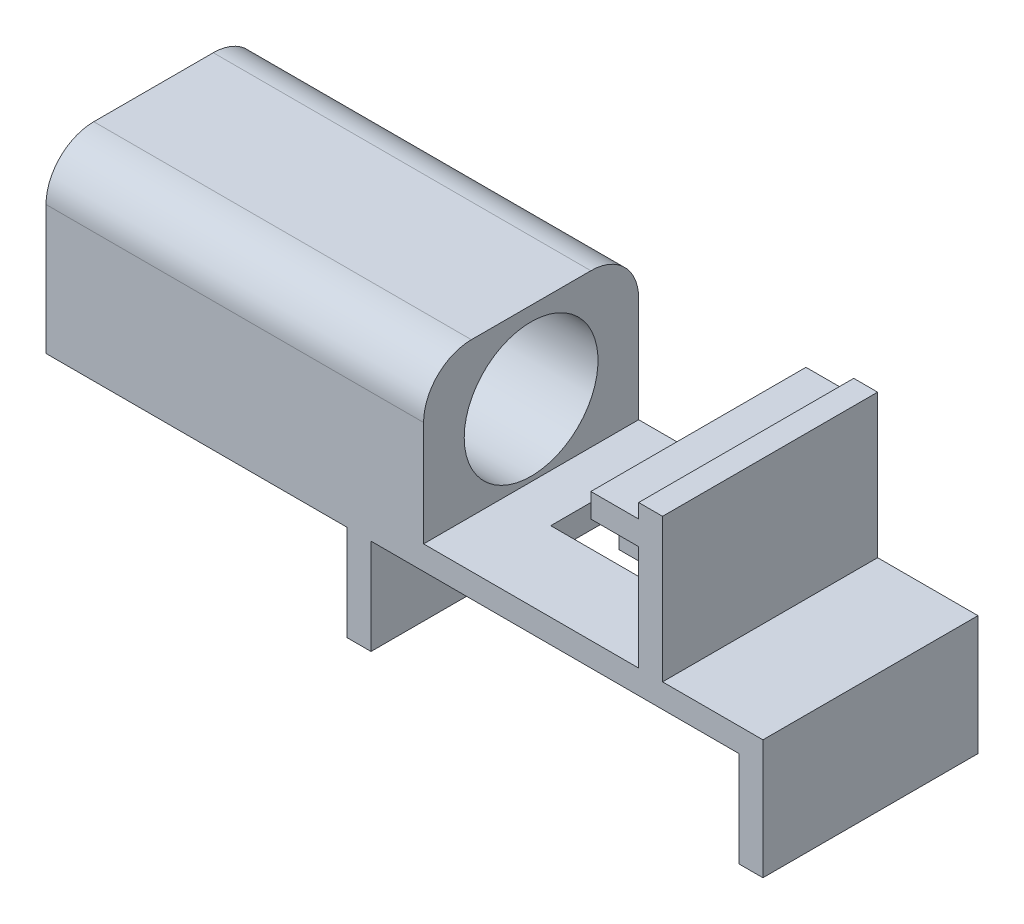
from build123d import *

# Parameters (mm, degrees)
SKETCH1_W           = 150
SKETCH1_H           = 45
BOSS_EXTRUDE1_DEPTH = 5
SKETCH2_W           = 5
SKETCH2_H           = 45
BOSS_EXTRUDE2_DEPTH = 20
SKETCH3_W           = 5
SKETCH3_H           = 45
BOSS_EXTRUDE3_DEPTH = 20
SKETCH4_W           = 35
SKETCH4_H           = 11.8
CUT_EXTRUDE1_DEPTH  = 81.816149376
SKETCH5_W           = 30
SKETCH5_H           = 3
BOSS_EXTRUDE4_DEPTH = 4
SKETCH7_W           = 5
SKETCH7_H           = 45
BOSS_EXTRUDE5_DEPTH = 30
SKETCH8_W           = 79
SKETCH8_H           = 45
BOSS_EXTRUDE6_DEPTH = 32
CUT_EXTRUDE2_REACH  = 158.126
SKETCH9_R           = 14
FILLET1_R           = 10
SKETCH10_W          = 45
SKETCH10_H          = 5
BOSS_EXTRUDE7_DEPTH = 10
CUT_EXTRUDE3_REACH  = 88.604
SKETCH11_R          = 2.55
CUT_EXTRUDE4_DEPTH  = 4
LPATTERN1_COUNT     = 2
LPATTERN1_PITCH     = 30


with BuildPart() as part:
    # Sketch1 → Boss-Extrude1 (new body)
    with BuildSketch(Plane(origin=(0, 0, 0), x_dir=(1, 0, 0), z_dir=(0, 1, 0))):
        Rectangle(SKETCH1_W, SKETCH1_H)
    extrude(amount=BOSS_EXTRUDE1_DEPTH)

    # Sketch2 → Boss-Extrude2 (add)
    with BuildSketch(Plane.XZ):
        with Locations((72.5, 0)):
            Rectangle(SKETCH2_W, SKETCH2_H)
    extrude(amount=BOSS_EXTRUDE2_DEPTH)

    # Sketch3 → Boss-Extrude3 (add)
    with BuildSketch(Plane.XZ):
        with Locations((-9.5, 0)):
            Rectangle(SKETCH3_W, SKETCH3_H)
    extrude(amount=BOSS_EXTRUDE3_DEPTH)

    # Sketch4 → Cut-Extrude1 (cut, through all)
    with BuildSketch(Plane.XZ):
        with Locations((31.5, 0)):
            Rectangle(SKETCH4_W, SKETCH4_H)
    extrude(amount=-CUT_EXTRUDE1_DEPTH, mode=Mode.SUBTRACT)

    # Sketch5 → Boss-Extrude4 (add)
    with BuildSketch(Plane.XZ):
        with Locations((31.5, -7.4)):
            Rectangle(SKETCH5_W, SKETCH5_H)
    boss_extrude4 = extrude(amount=BOSS_EXTRUDE4_DEPTH)

    # Mirror1: Boss-Extrude4 across plane
    add(boss_extrude4.mirror(Plane.XY))

    # Sketch7 → Boss-Extrude5 (add)
    with BuildSketch(Plane(origin=(0, 5, 0), x_dir=(1, 0, 0), z_dir=(0, 1, 0))):
        with Locations((51.5, 0)):
            Rectangle(SKETCH7_W, SKETCH7_H)
    extrude(amount=BOSS_EXTRUDE5_DEPTH)

    # Sketch8 → Boss-Extrude6 (add)
    with BuildSketch(Plane(origin=(0, 5, 0), x_dir=(1, 0, 0), z_dir=(0, 1, 0))):
        with Locations((-35.5, 0)):
            Rectangle(SKETCH8_W, SKETCH8_H)
    extrude(amount=BOSS_EXTRUDE6_DEPTH)

    # Sketch9 → Cut-Extrude2 (cut, up to next)
    with BuildSketch(Plane.ZY.offset(75), mode=Mode.PRIVATE) as cut_extrude2_sk1:
        with Locations((0, 20)):
            Circle(SKETCH9_R)
    cut_extrude2_tool1 = extrude(cut_extrude2_sk1.sketch, amount=-CUT_EXTRUDE2_REACH, mode=Mode.PRIVATE) & part.part
    add(cut_extrude2_tool1.solids().sort_by_distance((-75, 20, 0))[0], mode=Mode.SUBTRACT)

    # Fillet1
    fillet1_edges = [part.edges().sort_by_distance(p)[0] for p in [
        (-35.5, 37, 22.5),
        (-35.5, 37, -22.5),
    ]]
    fillet(fillet1_edges, radius=FILLET1_R)

    # Sketch10 → Boss-Extrude7 (add)
    with BuildSketch(Plane.ZY.offset(-49)):
        with Locations((0, 29.5)):
            Rectangle(SKETCH10_W, SKETCH10_H)
    extrude(amount=BOSS_EXTRUDE7_DEPTH)

    # Sketch11 → Cut-Extrude3 (cut, up to next)
    with BuildSketch(Plane.XZ, mode=Mode.PRIVATE) as cut_extrude3_sk1:
        with Locations(Location((-60, 0, 0), (0, 0, 270))):
            Circle(SKETCH11_R)
    cut_extrude3_tool1 = extrude(cut_extrude3_sk1.sketch, amount=-CUT_EXTRUDE3_REACH, mode=Mode.PRIVATE) & part.part
    cut_extrude3 = cut_extrude3_tool1.solids().sort_by_distance((-60, 0, 0))[0]
    add(cut_extrude3, mode=Mode.SUBTRACT)

    # Sketch12 → Cut-Extrude4 (cut)
    with BuildSketch(Plane.XZ):
        Polygon((-55.95, -2.33826859), (-55.95, 2.33826859), (-60, 4.67653718), (-64.05, 2.33826859), (-64.05, -2.33826859), (-60, -4.67653718), align=None)
    cut_extrude4 = extrude(amount=-CUT_EXTRUDE4_DEPTH, mode=Mode.SUBTRACT)

    # LPattern1: Cut-Extrude3, Cut-Extrude4 ×2
    with Locations(*[(i * LPATTERN1_PITCH, 0, 0) for i in range(1, LPATTERN1_COUNT)]):
        add(cut_extrude3, mode=Mode.SUBTRACT)
        add(cut_extrude4, mode=Mode.SUBTRACT)


solid = part.part
